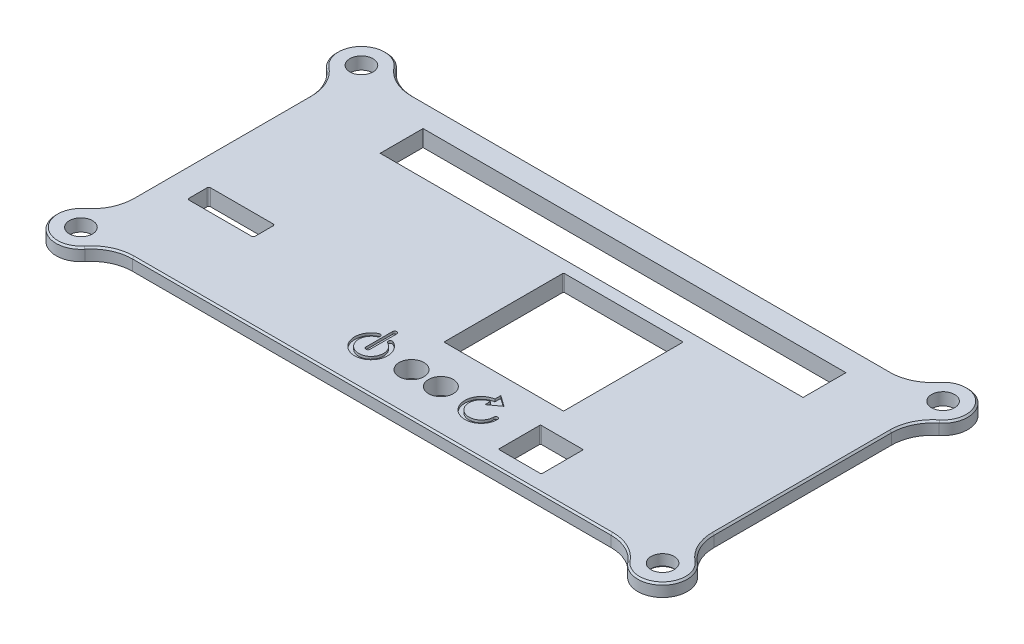
from build123d import *

# Parameters (mm, degrees)
SKETCH_1_R          = 1.4
EXTRUDE_1_DEPTH     = 1.5
FILLET_1_R          = 5
EXTRUDE_2_DEPTH     = 0.5
CUT_EXTRUDE_1_DEPTH = 2.5
SKETCH_3_W          = 51.26
SKETCH_3_H          = 5.2
CUT_EXTRUDE_2_DEPTH = 2.5
CUT_EXTRUDE_3_DEPTH = 2.5
SKETCH_5_R          = 1.5
CUT_EXTRUDE_4_DEPTH = 2.5
CUT_EXTRUDE_5_DEPTH = 0.3
CHAMFER_1_SIZE      = 0.2
CUT_EXTRUDE_6_DEPTH = 2


with BuildPart() as part:
    # 草图1 → 凸台-拉伸1 (new body)
    with BuildSketch(Plane(origin=(0, 0, 0), x_dir=(1, 0, 0), z_dir=(0, 1, 0))):
        with BuildLine():
            Line((3, 0), (67.5, 0))
            ThreePointArc((67.5, 0), (72.621320344, -2.121320344), (70.5, 3))
            Line((70.5, 3), (70.5, 31))
            ThreePointArc((70.5, 31), (72.621320344, 36.121320344), (67.5, 34))
            Line((67.5, 34), (3, 34))
            ThreePointArc((3, 34), (-2.121320344, 36.121320344), (0, 31))
            Line((0, 31), (0, 3))
            ThreePointArc((0, 3), (-2.121320344, -2.121320344), (3, 0))
        make_face()
        with Locations(Location((0, 0, 0), (0, 0, 270))):
            Circle(SKETCH_1_R, mode=Mode.SUBTRACT)
        with Locations(Location((70.5, 0, 0), (0, 0, 270))):
            Circle(SKETCH_1_R, mode=Mode.SUBTRACT)
        with Locations(Location((70.5, 34, 0), (0, 0, 270))):
            Circle(SKETCH_1_R, mode=Mode.SUBTRACT)
        with Locations(Location((0, 34, 0), (0, 0, 270))):
            Circle(SKETCH_1_R, mode=Mode.SUBTRACT)
    extrude(amount=EXTRUDE_1_DEPTH)

    # 圆角1
    fillet_1_edges = [part.edges().sort_by_distance(p)[0] for p in [
        (70.5, 0.75, -31),
        (70.5, 0.75, -3),
        (67.5, 0.75, 0),
        (3, 0.75, 0),
        (0, 0.75, -3),
        (0, 0.75, -31),
        (3, 0.75, -34),
        (67.5, 0.75, -34),
    ]]
    fillet(fillet_1_edges, radius=FILLET_1_R)

    # 草图9 → 凸台-拉伸2 (add)
    with BuildSketch(Plane.XZ):
        with BuildLine():
            Line((3.2, -4.5), (3.2, -29.5))
            ThreePointArc((3.2, -29.5), (4.020101013, -31.479898987), (6, -32.3))
            Line((6, -32.3), (66, -32.3))
            ThreePointArc((66, -32.3), (67.979898987, -31.479898987), (68.8, -29.5))
            Line((68.8, -29.5), (68.8, -4.5))
            ThreePointArc((68.8, -4.5), (67.979898987, -2.520101013), (66, -1.7))
            Line((66, -1.7), (6, -1.7))
            ThreePointArc((6, -1.7), (4.020101013, -2.520101013), (3.2, -4.5))
        make_face()
    extrude(amount=EXTRUDE_2_DEPTH)

    # 草图2 → 切除-拉伸1 (cut)
    with BuildSketch(Plane(origin=(0, 1.5, 0), x_dir=(1, 0, 0), z_dir=(0, 1, 0))):
        with BuildLine():
            Line((48.45, 9.95), (34.15, 9.95))
            ThreePointArc((34.15, 9.95), (34.079289322, 9.979289322), (34.05, 10.05))
            Line((34.05, 10.05), (34.05, 24.35))
            ThreePointArc((34.05, 24.35), (34.079289322, 24.420710678), (34.15, 24.45))
            Line((34.15, 24.45), (48.45, 24.45))
            ThreePointArc((48.45, 24.45), (48.520710678, 24.420710678), (48.55, 24.35))
            Line((48.55, 24.35), (48.55, 10.05))
            ThreePointArc((48.55, 10.05), (48.520710678, 9.979289322), (48.45, 9.95))
        make_face()
    extrude(amount=-CUT_EXTRUDE_1_DEPTH, mode=Mode.SUBTRACT)

    # 草图3 → 切除-拉伸2 (cut)
    with BuildSketch(Plane(origin=(0, 1.5, 0), x_dir=(1, 0, 0), z_dir=(0, 1, 0))):
        with Locations((36, 28.5)):
            Rectangle(SKETCH_3_W, SKETCH_3_H)
    extrude(amount=-CUT_EXTRUDE_2_DEPTH, mode=Mode.SUBTRACT)

    # 草图4 → 切除-拉伸3 (cut)
    with BuildSketch(Plane(origin=(0, 1.5, 0), x_dir=(1, 0, 0), z_dir=(0, 1, 0))):
        with BuildLine():
            Line((48.7, 7.1), (53.7, 7.1))
            ThreePointArc((53.7, 7.1), (53.770710678, 7.070710678), (53.8, 7))
            Line((53.8, 7), (53.8, 2.1))
            ThreePointArc((53.8, 2.1), (53.770710678, 2.029289322), (53.7, 2))
            Line((53.7, 2), (48.7, 2))
            ThreePointArc((48.7, 2), (48.629289322, 2.029289322), (48.6, 2.1))
            Line((48.6, 2.1), (48.6, 7))
            ThreePointArc((48.6, 7), (48.629289322, 7.070710678), (48.7, 7.1))
        make_face()
    extrude(amount=-CUT_EXTRUDE_3_DEPTH, mode=Mode.SUBTRACT)

    # 草图5 → 切除-拉伸4 (cut)
    with BuildSketch(Plane(origin=(0, 1.5, 0), x_dir=(1, 0, 0), z_dir=(0, 1, 0))):
        with Locations(Location((34.98, 5.09, 0), (0, 0, 270))):
            Circle(SKETCH_5_R)
        with Locations(Location((38.54, 5.09, 0), (0, 0, 270))):
            Circle(SKETCH_5_R)
    extrude(amount=-CUT_EXTRUDE_4_DEPTH, mode=Mode.SUBTRACT)

    # 草图7 → 切除-拉伸5 (cut)
    with BuildSketch(Plane(origin=(0, 1.5, 0), x_dir=(1, 0, 0), z_dir=(0, 1, 0))):
        with BuildLine():
            Line((43.10725502, 6.55256053), (43.098194404, 5.868627045))
            Line((43.098194404, 5.868627045), (44.440296605, 6.84))
            Line((44.440296605, 6.84), (43.123465549, 7.776199492))
            Line((43.123465549, 7.776199492), (43.114019957, 7.063206413))
            ThreePointArc((43.114019957, 7.063206413), (42.146572001, 3.56478636), (45.440296605, 5.09))
            ThreePointArc((45.440296605, 5.09), (45.190296605, 5.34), (44.940296605, 5.09))
            ThreePointArc((44.940296605, 5.09), (42.504765307, 3.917489365), (43.10725502, 6.55256053))
        make_face()
        with BuildLine():
            Line((29.833898496, 4.717073646), (29.833898496, 7.938528917))
            ThreePointArc((29.833898496, 7.938528917), (30.083898496, 8.188528917), (30.333898496, 7.938528917))
            Line((30.333898496, 7.938528917), (30.333898496, 4.717073646))
            ThreePointArc((30.333898496, 4.717073646), (30.083898496, 4.467073646), (29.833898496, 4.717073646))
        make_face()
        with BuildLine():
            ThreePointArc((29.235650456, 6.901208233), (30.08487931, 3.09000024), (30.930369668, 6.902039336))
            ThreePointArc((30.930369668, 6.902039336), (30.598055855, 6.781343315), (30.718751875, 6.449029502))
            ThreePointArc((30.718751875, 6.449029502), (30.084634106, 3.59000018), (29.447712466, 6.448406175))
            ThreePointArc((29.447712466, 6.448406175), (29.56808249, 6.780838209), (29.235650456, 6.901208233))
        make_face()
    extrude(amount=-CUT_EXTRUDE_5_DEPTH, mode=Mode.SUBTRACT)

    # 倒角1
    chamfer_1_edges = [part.edges().sort_by_distance(p)[0] for p in [
        (70.5, 0, -1.4),
        (72.621320344, 1.5, 2.121320344),
        (35.25, 1.5, 0),
        (-2.121320344, 1.5, 2.121320344),
        (0, 1.5, -17),
        (-2.121320344, 1.5, -36.121320344),
        (35.25, 1.5, -34),
        (72.621320344, 1.5, -36.121320344),
        (70.5, 1.5, -17),
        (66.420065511, 1.5, 0.493060906),
        (4.079934489, 1.5, 0.493060906),
        (-0.493060906, 1.5, -4.079934489),
        (-0.493060906, 1.5, -29.920065511),
        (4.079934489, 1.5, -34.493060906),
        (66.420065511, 1.5, -34.493060906),
        (70.993060906, 1.5, -29.920065511),
        (70.993060906, 1.5, -4.079934489),
    ]]
    chamfer(chamfer_1_edges, length=CHAMFER_1_SIZE)

    # 草图10 → 切除-拉伸6 (cut)
    with BuildSketch(Plane(origin=(0, 1.5, 0), x_dir=(1, 0, 0), z_dir=(0, 1, 0))):
        with BuildLine():
            Line((3.7, 9.4), (11.3, 9.4))
            ThreePointArc((11.3, 9.4), (11.441421356, 9.458578644), (11.5, 9.6))
            Line((11.5, 9.6), (11.5, 11.8))
            ThreePointArc((11.5, 11.8), (11.441421356, 11.941421356), (11.3, 12))
            Line((11.3, 12), (3.7, 12))
            ThreePointArc((3.7, 12), (3.558578644, 11.941421356), (3.5, 11.8))
            Line((3.5, 11.8), (3.5, 9.6))
            ThreePointArc((3.5, 9.6), (3.558578644, 9.458578644), (3.7, 9.4))
        make_face()
    extrude(amount=-CUT_EXTRUDE_6_DEPTH, mode=Mode.SUBTRACT)


solid = part.part
